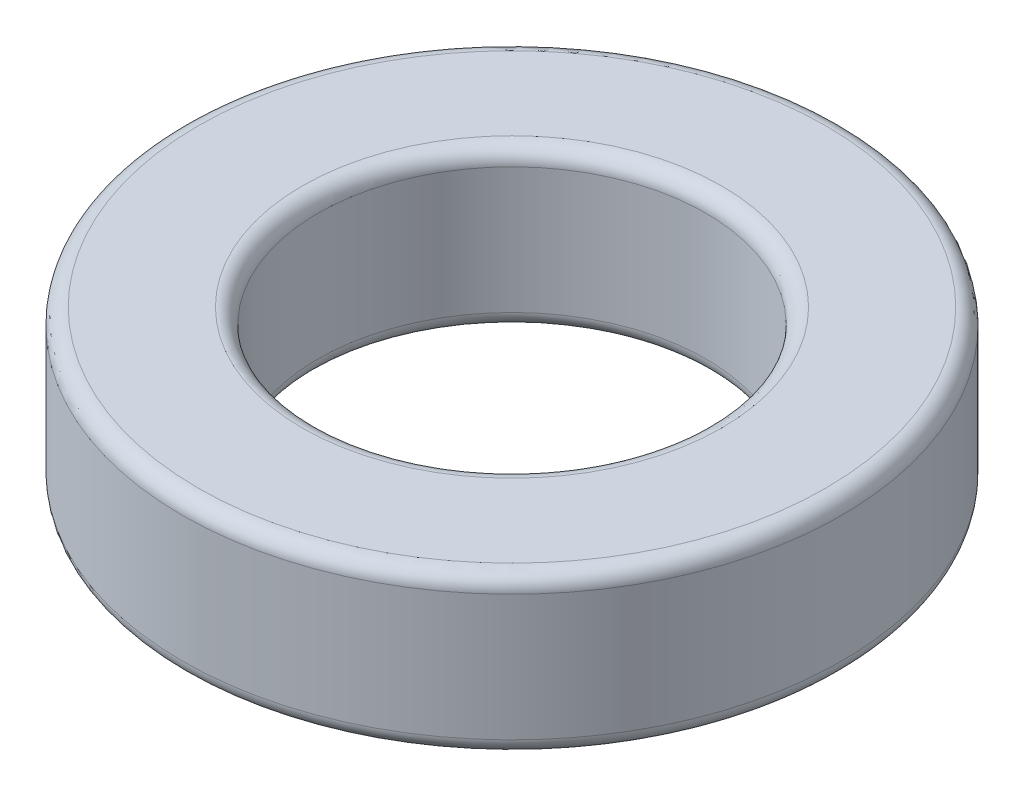
from build123d import *

# Parameters (mm, degrees)
SKETCH_1_R      = 10.45
SKETCH_1_R_2    = 6.15
EXTRUDE_1_DEPTH = 5
FILLET_1_R      = 0.5


with BuildPart() as part:
    # Эскиз1 → Бобышка-Вытянуть1 (new body)
    with BuildSketch(Plane(origin=(0, 0, 0), x_dir=(1, 0, 0), z_dir=(0, 1, 0))):
        with Locations(Location((0, 0, 0), (0, 0, 270))):
            Circle(SKETCH_1_R)
        with Locations(Location((0, 0, 0), (0, 0, 270))):
            Circle(SKETCH_1_R_2, mode=Mode.SUBTRACT)
    extrude(amount=EXTRUDE_1_DEPTH)

    # Скругление1
    fillet_1_edges = [part.edges().sort_by_distance(p)[0] for p in [
        (0, 0, -10.45),
        (0, 5, -10.45),
        (0, 0, -6.15),
        (0, 5, -6.15),
    ]]
    fillet(fillet_1_edges, radius=FILLET_1_R)


solid = part.part
